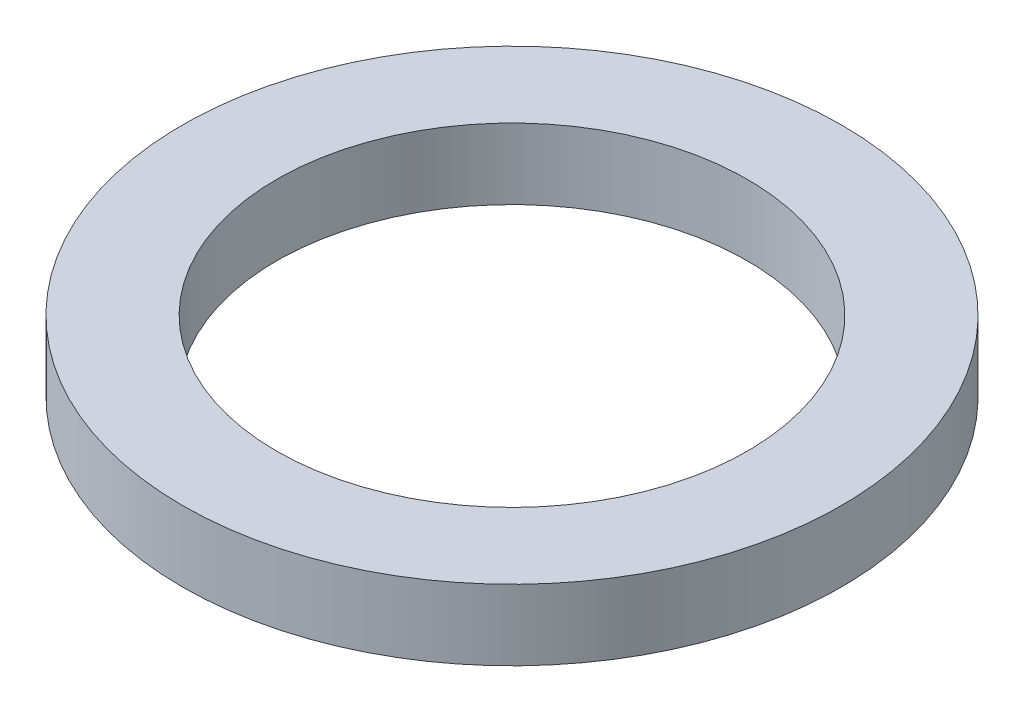
from build123d import *

# Parameters (mm, degrees)
SKETCH1_R           = 14
SKETCH1_R_2         = 10
BOSS_EXTRUDE1_DEPTH = 3


with BuildPart() as part:
    # Sketch1 → Boss-Extrude1 (new body)
    with BuildSketch(Plane(origin=(0, 0, 0), x_dir=(1, 0, 0), z_dir=(0, 1, 0))):
        with Locations(Location((0, 0, 0), (0, 0, 270))):
            Circle(SKETCH1_R)
        with Locations(Location((0, 0, 0), (0, 0, 270))):
            Circle(SKETCH1_R_2, mode=Mode.SUBTRACT)
    extrude(amount=BOSS_EXTRUDE1_DEPTH)


solid = part.part
